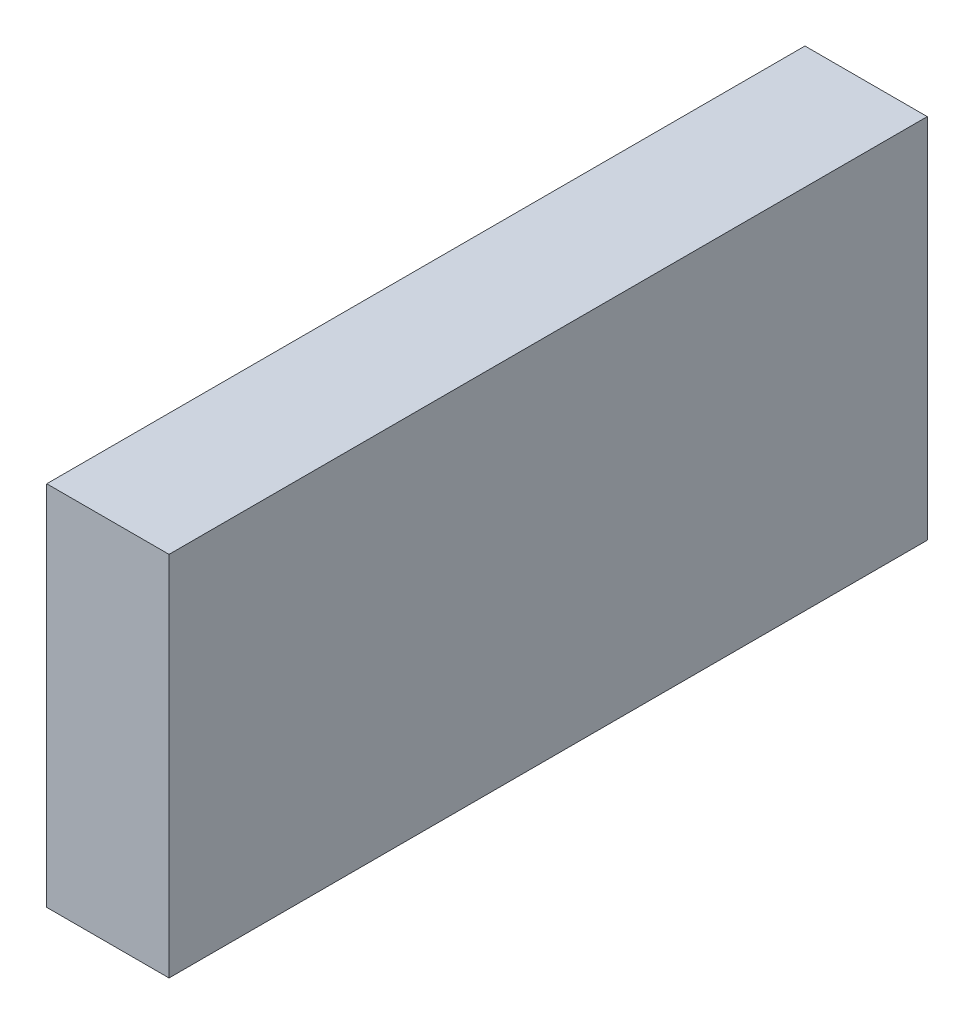
from build123d import *

# Parameters (mm, degrees)
SKETCH1_W           = 20
SKETCH1_H           = 60
BOSS_EXTRUDE1_DEPTH = 62


with BuildPart() as part:
    # Sketch1 → Boss-Extrude1 (new, symmetric)
    with BuildSketch(Plane.XY):
        Rectangle(SKETCH1_W, SKETCH1_H)
    extrude(amount=BOSS_EXTRUDE1_DEPTH, both=True)


solid = part.part
